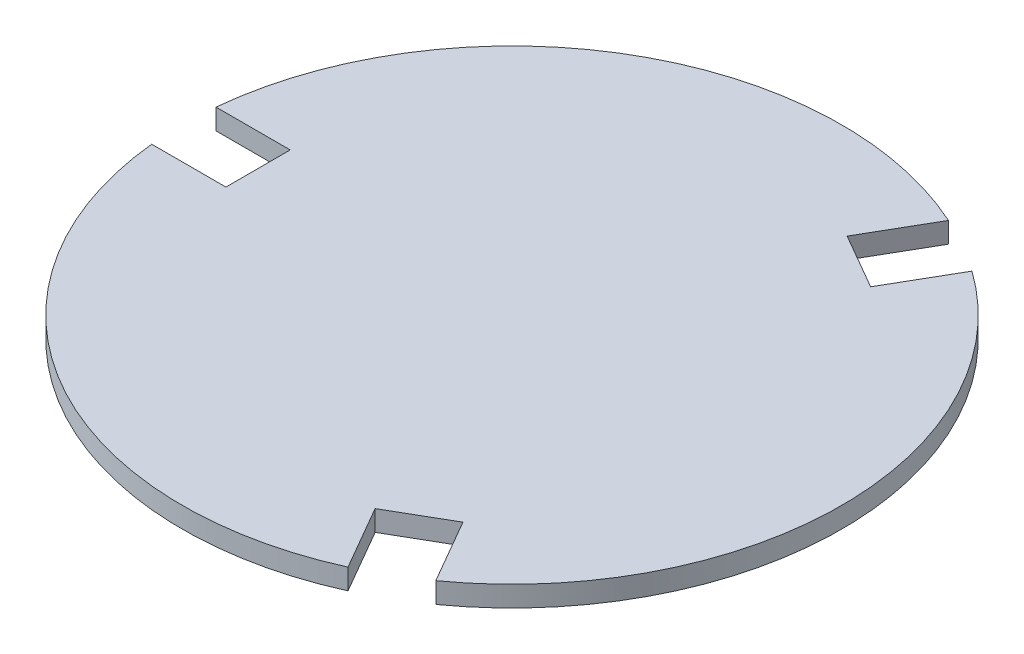
from build123d import *

# Parameters (mm, degrees)
SKETCH1_R         = 50.8
EXTRUDE1_DEPTH    = 3.175
EXTRUDE2_DEPTH    = 72.912172996
CIRPATTERN1_COUNT = 2
CIRPATTERN1_ANGLE = 120
CIRPATTERN2_COUNT = 2
CIRPATTERN2_ANGLE = 120


with BuildPart() as part:
    # Sketch1 → Extrude1 (new body)
    with BuildSketch(Plane(origin=(0, 0, 0), x_dir=(1, 0, 0), z_dir=(0, 1, 0))):
        with Locations(Location((0, 0, 0), (0, 0, 270))):
            Circle(SKETCH1_R)
    extrude(amount=EXTRUDE1_DEPTH)

    # Sketch3 → Extrude2 (cut, through all)
    with BuildSketch(Plane(origin=(0, 3.175, 0), x_dir=(-1, 0, 0), z_dir=(0, 1, 0))):
        Polygon((42.177913697, -4.953), (39.127964664, -4.953), (39.127964664, 4.953), (42.302964664, 4.953), (50.557964664, 4.953), (52.875390068, 4.953), (52.875390068, -4.953), (50.557964664, -4.953), align=None)
    extrude2 = extrude(amount=-EXTRUDE2_DEPTH, mode=Mode.SUBTRACT)

    # CirPattern1: Extrude2 ×2 about axis
    cirpattern1_axis = Axis((0, 38.178274824, 0), (0, -1, 0))
    for i in range(1, CIRPATTERN1_COUNT):
        add(extrude2.rotate(cirpattern1_axis, i * CIRPATTERN1_ANGLE / (CIRPATTERN1_COUNT - 1)), mode=Mode.SUBTRACT)

    # CirPattern2: Extrude2 ×2 about axis
    cirpattern2_axis = Axis((0, 0, 0), (0, 1, 0))
    for i in range(1, CIRPATTERN2_COUNT):
        add(extrude2.rotate(cirpattern2_axis, i * CIRPATTERN2_ANGLE / (CIRPATTERN2_COUNT - 1)), mode=Mode.SUBTRACT)


solid = part.part
